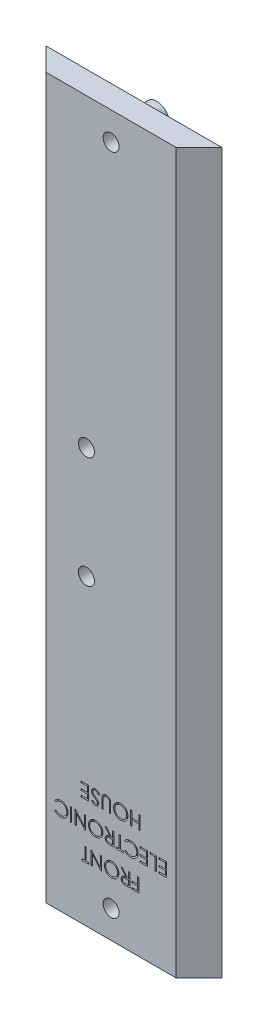
from build123d import *

# Parameters (mm, degrees)
SKETCH3_W           = 157
SKETCH3_H           = 39.86
BOSS_EXTRUDE1_DEPTH = 5
CUT_EXTRUDE2_DEPTH  = 157
SKETCH6_R           = 1.75
CUT_EXTRUDE3_DEPTH  = 5
SKETCH7_R           = 2.75
BOSS_EXTRUDE3_DEPTH = 5
SKETCH8_R           = 1.712369462
SKETCH8_R_2         = 1.75
CUT_EXTRUDE5_DEPTH  = 5
CUT_EXTRUDE8_DEPTH  = 157
BOSS_EXTRUDE5_DEPTH = 0.4
SKETCH14_W          = 0.26923077
SKETCH14_H          = 3
CUT_EXTRUDE9_DEPTH  = 1


with BuildPart() as part:
    # Sketch3 → Boss-Extrude1 (new body)
    with BuildSketch(Plane(origin=(0, 0, 0), x_dir=(0, 1, 0), z_dir=(0, 0, 1))):
        with Locations((78.5, 19.93)):
            Rectangle(SKETCH3_W, SKETCH3_H)
    extrude(amount=BOSS_EXTRUDE1_DEPTH)

    # Sketch4 → Cut-Extrude2 (cut)
    with BuildSketch(Plane.XZ):
        Polygon((-39.86, 5), (-34.861635274, 5), (-39.86, 0), align=None)
        Polygon((0, 0), (0, 5), (-5, 5), align=None)
    extrude(amount=-CUT_EXTRUDE2_DEPTH, mode=Mode.SUBTRACT)

    # Sketch6 → Cut-Extrude3 (cut)
    with BuildSketch(Plane.XY.offset(5)):
        with Locations((-19.930817637, 6.08)):
            Circle(SKETCH6_R)
        with Locations((-19.930817637, 151.28)):
            Circle(SKETCH6_R)
        with Locations((-25.331635274, 90.7)):
            Circle(SKETCH6_R)
        with Locations((-25.331635274, 66.3)):
            Circle(SKETCH6_R)
    extrude(amount=-CUT_EXTRUDE3_DEPTH, mode=Mode.SUBTRACT)

    # Sketch7 → Boss-Extrude3 (add)
    with BuildSketch(Plane(origin=(0, 0, 0), x_dir=(1, 0, 0), z_dir=(0, 0, -1))):
        with Locations(Location((-26.33, -20, 0), (0, 0, 180))):
            Circle(SKETCH7_R)
        with Locations(Location((-13.53, -20, 0), (0, 0, 180))):
            Circle(SKETCH7_R)
        with Locations(Location((-13.53, -40.35, 0), (0, 0, 180))):
            Circle(SKETCH7_R)
        with Locations(Location((-26.33, -40.35, 0), (0, 0, 180))):
            Circle(SKETCH7_R)
        with Locations(Location((-19.930817637, -6.08, 0), (0, 0, 180))):
            Circle(SKETCH7_R)
        with Locations(Location((-19.930817637, -151.28, 0), (0, 0, 180))):
            Circle(SKETCH7_R)
        with Locations(Location((-33.780719465, -93.522998029, 0), (0, 0, 180))):
            Circle(SKETCH7_R)
        with Locations(Location((-33.801017707, -65.312190292, 0), (0, 0, 180))):
            Circle(SKETCH7_R)
        with Locations(Location((-16.973820781, -67.535876943, 0), (0, 0, 180))):
            Circle(SKETCH7_R)
    extrude(amount=BOSS_EXTRUDE3_DEPTH)

    # Sketch8 → Cut-Extrude5 (cut)
    with BuildSketch(Plane(origin=(0, 0, 0), x_dir=(1, 0, 0), z_dir=(0, 0, -1))):
        with Locations(Location((-26.33, -20, 0), (0, 0, 180))):
            Circle(SKETCH8_R)
        with Locations(Location((-26.33, -40.35, 0), (0, 0, 180))):
            Circle(SKETCH8_R)
        with Locations(Location((-13.53, -40.35, 0), (0, 0, 180))):
            Circle(SKETCH8_R)
        with Locations(Location((-13.53, -20, 0), (0, 0, 180))):
            Circle(SKETCH8_R)
        with Locations(Location((-19.930817637, -6.08, 0), (0, 0, 180))):
            Circle(SKETCH8_R)
        with Locations((-19.930817637, -151.28)):
            Circle(SKETCH8_R_2)
        with Locations(Location((-33.801635274, -65.31, 0), (0, 0, 180))):
            Circle(SKETCH8_R_2)
        with Locations(Location((-16.971635274, -67.54, 0), (0, 0, 180))):
            Circle(SKETCH8_R_2)
        with Locations(Location((-33.781635274, -93.52, 0), (0, 0, 180))):
            Circle(SKETCH8_R_2)
    extrude(amount=CUT_EXTRUDE5_DEPTH, mode=Mode.SUBTRACT)

    # Sketch12 → Cut-Extrude8 (cut)
    with BuildSketch(Plane(origin=(0, 157, 0), x_dir=(-1, 0, 0), z_dir=(0, 1, 0))):
        Polygon((0, 0), (0.394619077, -0.30704362), (5.701662696, 5), (5, 5), align=None)
        Polygon((39.86, 0), (39.506446609, -0.353553391), (34.152893219, 5), (34.861635274, 5), align=None)
    extrude(amount=-CUT_EXTRUDE8_DEPTH, mode=Mode.SUBTRACT)

    # Sketch13 → Boss-Extrude5 (add)
    with BuildSketch(Plane(origin=(0, 157, 0), x_dir=(-1, 0, 0), z_dir=(0, 1, 0))):
        Polygon((0.701662696, 0), (5.701662696, 5), (34.152893219, 5), (39.152893219, 0), align=None)
    extrude(amount=BOSS_EXTRUDE5_DEPTH)

    # Sketch14 → Cut-Extrude9 (cut)
    # profile 1 of 20: a face of its own
    with BuildSketch(Plane.XY.offset(5)):
        Polygon((-13.850354881, 12), (-15.311893342, 12), (-15.311893342, 12.307692308), (-14.11958565, 12.307692308), (-14.11958565, 13.230769231), (-15.311893342, 13.230769231), (-15.311893342, 13.538461538), (-14.11958565, 13.538461538), (-14.11958565, 15), (-13.850354881, 15), align=None)
    # profile 2 of 20: a face of its own
    with BuildSketch(Plane.XY.offset(5)):
        with BuildLine():
            Line((-15.850354881, 12), (-16.450715458, 12))
            add(Edge.make_bspline(
                [(-16.450715458, 12), (-16.490779282, 12.000133359), (-16.567706263, 12.000389424), (-16.677911923, 12.001817221), (-16.778049435, 12.005909526), (-16.86806644, 12.009431169), (-16.947961287, 12.015852833), (-17.017978965, 12.02199053), (-17.077796991, 12.030025097), (-17.114007721, 12.037486888), (-17.130402958, 12.040865385)],
                knots=[0, 0, 0, 0, 1.410062039, 2.707475311, 3.878576406, 4.937260626, 5.877586885, 6.699081471, 7.410979367, 8, 8, 8, 8], degree=3))
            add(Edge.make_bspline(
                [(-17.130402958, 12.040865385), (-17.152351862, 12.046287726), (-17.195781441, 12.057016735), (-17.258304708, 12.079705105), (-17.317908194, 12.105918357), (-17.374373631, 12.136941955), (-17.427686221, 12.172252027), (-17.477840595, 12.21199052), (-17.524164279, 12.256497911), (-17.5683054, 12.30393053), (-17.606849031, 12.356353534), (-17.641548523, 12.411106595), (-17.670677558, 12.469243846), (-17.693598858, 12.530472055), (-17.712814454, 12.594190605), (-17.725729129, 12.661029122), (-17.733772615, 12.730770147), (-17.734567311, 12.778222678), (-17.734970265, 12.802283654)],
                knots=[0, 0, 0, 0, 1.027276577, 2.032638556, 3.019345632, 3.985365262, 4.957888996, 5.923693931, 6.890056973, 7.876427719, 8.865527834, 9.843495157, 10.821038291, 11.815616373, 12.812734995, 13.843357168, 14.906466538, 16, 16, 16, 16], degree=3))
            add(Edge.make_bspline(
                [(-17.734970265, 12.802283654), (-17.733711157, 12.842256647), (-17.73125431, 12.920254309), (-17.708346622, 13.033448708), (-17.67082556, 13.139041898), (-17.619113734, 13.236886932), (-17.553291228, 13.325128092), (-17.474187543, 13.402371039), (-17.382206657, 13.467606228), (-17.296176467, 13.512363317), (-17.220145852, 13.541161946), (-17.157368992, 13.561526488), (-17.088838052, 13.576995325), (-17.015536211, 13.591054337), (-16.936897279, 13.601782492), (-16.853079616, 13.609401521), (-16.763873588, 13.614300615), (-16.702725221, 13.615016394), (-16.671268342, 13.615384615)],
                knots=[0, 0, 0, 0, 1.260402266, 2.459371274, 3.627181936, 4.786749125, 5.93865593, 7.087644312, 8.261344208, 9.485713728, 10.136162886, 10.825977872, 11.566646758, 12.35154167, 13.181268117, 14.0701832, 15.007234106, 16, 16, 16, 16], degree=3))
            Line((-16.671268342, 13.615384615), (-17.773431804, 15))
            Line((-17.773431804, 15), (-17.440499111, 15))
            Line((-17.440499111, 15), (-16.33833565, 13.615384615))
            Line((-16.33833565, 13.615384615), (-16.11958565, 13.615384615))
            Line((-16.11958565, 13.615384615), (-16.11958565, 15))
            Line((-16.11958565, 15), (-15.850354881, 15))
            Line((-15.850354881, 15), (-15.850354881, 12))
        make_face()
        with BuildLine():
            Line((-16.11958565, 12.307692308), (-16.11958565, 13.307692308))
            Line((-16.11958565, 13.307692308), (-16.668864496, 13.311899038))
            add(Edge.make_bspline(
                [(-16.668864496, 13.311899038), (-16.694510247, 13.311910391), (-16.744219016, 13.311932395), (-16.816133828, 13.30850907), (-16.883094073, 13.304615097), (-16.944842792, 13.298657514), (-17.001410347, 13.290984171), (-17.052759374, 13.281370882), (-17.099003348, 13.270218368), (-17.152765612, 13.252780552), (-17.213490178, 13.226344724), (-17.27812331, 13.185353674), (-17.334643133, 13.135781041), (-17.381633125, 13.078378592), (-17.41937554, 13.014994425), (-17.44559101, 12.947063018), (-17.462866851, 12.875654696), (-17.464770908, 12.826624311), (-17.465739496, 12.801682692)],
                knots=[0, 0, 0, 0, 1.146399208, 2.222048177, 3.218135709, 4.144938032, 4.994811973, 5.769438708, 6.479732432, 7.119818093, 8.294689872, 9.430121864, 10.527913442, 11.641375077, 12.733452768, 13.811150417, 14.886538365, 16, 16, 16, 16], degree=3))
            add(Edge.make_bspline(
                [(-17.465739496, 12.801682692), (-17.464721865, 12.77755234), (-17.46270529, 12.729734785), (-17.445866078, 12.659888671), (-17.418370312, 12.593474183), (-17.380735665, 12.531405229), (-17.333895311, 12.475480225), (-17.279336847, 12.427776116), (-17.218344157, 12.388144903), (-17.161799964, 12.361996131), (-17.110890277, 12.346610154), (-17.066891813, 12.335441489), (-17.016743865, 12.327619463), (-16.961036669, 12.320425288), (-16.899525506, 12.314332925), (-16.832172892, 12.310289114), (-16.759026984, 12.307872121), (-16.708329628, 12.307753641), (-16.68208565, 12.307692308)],
                knots=[0, 0, 0, 0, 1.100596872, 2.180981401, 3.259506136, 4.371595435, 5.481727359, 6.576991111, 7.667816242, 8.793363246, 9.406619729, 10.09427138, 10.864108636, 11.721733836, 12.6590937, 13.685439239, 14.801845161, 16, 16, 16, 16], degree=3))
            Line((-16.68208565, 12.307692308), (-16.11958565, 12.307692308))
        make_face(mode=Mode.SUBTRACT)
    # profile 3 of 20: a face of its own
    with BuildSketch(Plane.XY.offset(5)):
        with BuildLine():
            add(Edge.make_bspline(
                [(-19.792662573, 11.923076923), (-19.848218424, 11.924460232), (-19.957334698, 11.927177166), (-20.117553303, 11.948661086), (-20.270969071, 11.98402234), (-20.417673632, 12.033956593), (-20.557096418, 12.098702264), (-20.689678224, 12.177304961), (-20.81496333, 12.270537195), (-20.932627694, 12.376185793), (-21.039573223, 12.492315675), (-21.132633164, 12.616989285), (-21.211835853, 12.747697291), (-21.276547281, 12.88529091), (-21.327395284, 13.029155827), (-21.362463127, 13.180149078), (-21.384868792, 13.337267976), (-21.387487818, 13.444434015), (-21.388816419, 13.498798077)],
                knots=[0, 0, 0, 0, 1.065027606, 2.091802087, 3.093458616, 4.079833113, 5.057734272, 6.036020118, 7.030157768, 8.047461502, 9.064242947, 10.052216774, 11.02588392, 11.989864716, 12.962978571, 13.945936472, 14.957997893, 16, 16, 16, 16], degree=3))
            add(Edge.make_bspline(
                [(-21.388816419, 13.498798077), (-21.387487373, 13.552761369), (-21.384867669, 13.65912927), (-21.362444921, 13.815255565), (-21.327238899, 13.96532103), (-21.277176318, 14.108976633), (-21.212417224, 14.246292907), (-21.133089909, 14.377092365), (-21.040239046, 14.502129509), (-20.933731997, 14.618824704), (-20.81742543, 14.725780098), (-20.693522087, 14.820330275), (-20.562171482, 14.899095993), (-20.425423676, 14.964774801), (-20.281917725, 15.014517724), (-20.132665739, 15.050766295), (-19.976821449, 15.072946155), (-19.870660186, 15.07558289), (-19.816701034, 15.076923077)],
                knots=[0, 0, 0, 0, 1.043683505, 2.0572211, 3.045299494, 4.022276905, 4.994977706, 5.977452478, 6.97747046, 8.003698437, 9.029677512, 10.031249186, 11.013723958, 11.988083691, 12.9614021, 13.946617861, 14.956316495, 16, 16, 16, 16], degree=3))
            add(Edge.make_bspline(
                [(-19.816701034, 15.076923077), (-19.762337226, 15.075595209), (-19.655171689, 15.072977629), (-19.497855754, 15.050533869), (-19.346754956, 15.015450694), (-19.20233453, 14.965265467), (-19.064547086, 14.900651121), (-18.933405948, 14.821249686), (-18.80875353, 14.727685999), (-18.691858315, 14.621262592), (-18.58503189, 14.505179049), (-18.491071881, 14.381438394), (-18.412128212, 14.251217469), (-18.347486589, 14.115053071), (-18.296357527, 13.973297161), (-18.261464452, 13.825058041), (-18.238891655, 13.671166376), (-18.236290238, 13.56638684), (-18.234970265, 13.513221154)],
                knots=[0, 0, 0, 0, 1.053167129, 2.076072758, 3.073341244, 4.055601477, 5.033424535, 6.017524495, 7.021518915, 8.049444456, 9.077120685, 10.074910483, 11.055688766, 12.022980584, 12.991883888, 13.970269434, 14.970104079, 16, 16, 16, 16], degree=3))
            add(Edge.make_bspline(
                [(-18.234970265, 13.513221154), (-18.235428104, 13.477535846), (-18.236338006, 13.406615416), (-18.247308496, 13.301303587), (-18.263195354, 13.197674029), (-18.286082808, 13.096075095), (-18.315605683, 12.996490195), (-18.351987618, 12.899122984), (-18.393681329, 12.803171442), (-18.443323451, 12.710461699), (-18.497484492, 12.620848239), (-18.556541666, 12.535451605), (-18.620906746, 12.45579721), (-18.689660293, 12.380605136), (-18.763754009, 12.311158741), (-18.842072787, 12.245943934), (-18.925026426, 12.185635794), (-19.012746119, 12.131500958), (-19.102995419, 12.081777454), (-19.19642909, 12.04026242), (-19.291075774, 12.003568697), (-19.387769158, 11.974408069), (-19.486285573, 11.951201867), (-19.586748175, 11.93543384), (-19.68905349, 11.924438973), (-19.75797762, 11.923532893), (-19.792662573, 11.923076923)],
                knots=[0, 0, 0, 0, 1.037115869, 2.061148057, 3.07517727, 4.084041727, 5.086514338, 6.092668487, 7.104487461, 8.125783165, 9.147610153, 10.147694368, 11.141876323, 12.122903372, 13.107606018, 14.091946891, 15.084523921, 16.086505767, 17.087268121, 18.077809654, 19.05670789, 20.036870126, 21.011670792, 21.99694167, 22.991993299, 24, 24, 24, 24], degree=3))
        make_face()
        with BuildLine():
            add(Edge.make_bspline(
                [(-19.805883727, 12.230769231), (-19.777413612, 12.231114903), (-19.720745557, 12.231802943), (-19.636508017, 12.24092248), (-19.553348172, 12.253814324), (-19.471448722, 12.272585726), (-19.390736426, 12.296637826), (-19.311121695, 12.326338727), (-19.232533432, 12.361012516), (-19.155690287, 12.401260994), (-19.081819475, 12.446375359), (-19.010477134, 12.493940878), (-18.944387917, 12.546653502), (-18.882275287, 12.602558455), (-18.824289937, 12.662425469), (-18.77042412, 12.725813531), (-18.720730906, 12.793009612), (-18.675805945, 12.863733738), (-18.635826362, 12.937591963), (-18.600030931, 13.013172188), (-18.570357893, 13.091362704), (-18.546852424, 13.171675562), (-18.526901667, 13.253756845), (-18.514387076, 13.33805376), (-18.505180164, 13.424275706), (-18.504529924, 13.482546199), (-18.504201034, 13.512019231)],
                knots=[0, 0, 0, 0, 1.008431664, 2.007222653, 2.999229743, 3.989431819, 4.982149843, 5.98167215, 6.998687425, 8.024288174, 9.053028776, 10.065052016, 11.06063401, 12.045759335, 13.024701188, 14.011819507, 14.991481775, 15.984022113, 16.97831254, 17.965966747, 18.945551853, 19.938269878, 20.93007375, 21.936103907, 22.956087853, 24, 24, 24, 24], degree=3))
            add(Edge.make_bspline(
                [(-18.504201034, 13.512019231), (-18.505296273, 13.555357292), (-18.507450947, 13.640616665), (-18.526236051, 13.765574847), (-18.555401779, 13.885781868), (-18.597686576, 14.000521247), (-18.651629179, 14.110304639), (-18.717428203, 14.214704806), (-18.795686228, 14.313690952), (-18.884528188, 14.406526223), (-18.981674529, 14.49122692), (-19.084780204, 14.565679277), (-19.19302948, 14.628340458), (-19.305798435, 14.680723797), (-19.424049871, 14.720187225), (-19.547025606, 14.748324631), (-19.674728358, 14.766561284), (-19.761750382, 14.768332496), (-19.805883727, 14.769230769)],
                knots=[0, 0, 0, 0, 1.032022337, 2.030307203, 3.003823408, 3.974715386, 4.937372378, 5.913284036, 6.909147208, 7.938749767, 8.970518239, 9.975863271, 10.963918693, 11.946286286, 12.933361397, 13.927862637, 14.949112547, 16, 16, 16, 16], degree=3))
            add(Edge.make_bspline(
                [(-19.805883727, 14.769230769), (-19.835549131, 14.768823524), (-19.894384539, 14.768015835), (-19.981893263, 14.759869275), (-20.067833626, 14.746831538), (-20.152046561, 14.727966818), (-20.23464343, 14.704670283), (-20.315371203, 14.675768839), (-20.394217336, 14.641139654), (-20.471515764, 14.602484651), (-20.54559221, 14.558889057), (-20.615605452, 14.510988185), (-20.682015909, 14.460064616), (-20.744015167, 14.404564524), (-20.801758439, 14.345202517), (-20.854661551, 14.281546269), (-20.904331596, 14.21485357), (-20.94894146, 14.144147421), (-20.989469485, 14.070873611), (-21.024213375, 13.995073363), (-21.053903464, 13.917226768), (-21.077832411, 13.837257003), (-21.096594017, 13.755349206), (-21.109518946, 13.671384731), (-21.118560659, 13.585533976), (-21.119242127, 13.527467799), (-21.11958565, 13.498197115)],
                knots=[0, 0, 0, 0, 1.047362266, 2.077233941, 3.100744636, 4.115120168, 5.122788643, 6.129711893, 7.140355774, 8.162227187, 9.180148637, 10.17298275, 11.156396779, 12.133377858, 13.108923632, 14.078087502, 15.054351192, 16.043448276, 17.028082865, 18.009331763, 18.985518559, 19.968016174, 20.954783108, 21.950335389, 22.966780876, 24, 24, 24, 24], degree=3))
            add(Edge.make_bspline(
                [(-21.11958565, 13.498197115), (-21.119241839, 13.469126683), (-21.118559826, 13.411460126), (-21.109523419, 13.326207996), (-21.096579799, 13.2428481), (-21.077926049, 13.161707698), (-21.053883061, 13.082766104), (-21.024236774, 13.006097468), (-20.989277959, 12.93141614), (-20.949156577, 12.85890681), (-20.904057472, 12.789328211), (-20.854776055, 12.722812792), (-20.800465276, 12.660604097), (-20.742662651, 12.601187406), (-20.67997849, 12.545751127), (-20.612401804, 12.494509642), (-20.54161536, 12.445153469), (-20.466017619, 12.401474798), (-20.388280162, 12.360927742), (-20.308431082, 12.326363664), (-20.227468887, 12.296505898), (-20.145285443, 12.272689313), (-20.062022715, 12.253796089), (-19.977657569, 12.240927152), (-19.89222133, 12.231801963), (-19.834754254, 12.231114567), (-19.805883727, 12.230769231)],
                knots=[0, 0, 0, 0, 1.02988216, 2.042960975, 3.035124439, 4.018561492, 4.99104521, 5.957523397, 6.929462691, 7.91146347, 8.892205782, 9.866320947, 10.842813644, 11.816825305, 12.802668543, 13.805243666, 14.821427616, 15.858893029, 16.897256944, 17.927432741, 18.940436917, 19.95373962, 20.957947499, 21.96413624, 22.977215056, 24, 24, 24, 24], degree=3))
        make_face(mode=Mode.SUBTRACT)
    # profile 4 of 20: a face of its own
    with BuildSketch(Plane.XY.offset(5)):
        Polygon((-22.004201034, 15), (-22.004201034, 12), (-22.060691419, 12), (-24.042662573, 14.361177885), (-24.042662573, 12), (-24.311893342, 12), (-24.311893342, 15), (-24.250595265, 15), (-22.273431804, 12.644230769), (-22.273431804, 15), align=None)
    # profile 5 of 20: a face of its own
    with BuildSketch(Plane.XY.offset(5)):
        Polygon((-24.734970265, 12.307692308), (-24.734970265, 12), (-26.311893342, 12), (-26.311893342, 12.307692308), (-25.658047188, 12.307692308), (-25.658047188, 15), (-25.388816419, 15), (-25.388816419, 12.307692308), align=None)
    # profile 6 of 20: a face of its own
    with BuildSketch(Plane.XY.offset(5)):
        Polygon((-7.811893342, 17.961538462), (-9.504201034, 17.961538462), (-9.504201034, 18.269230769), (-8.081124111, 18.269230769), (-8.081124111, 19.192307692), (-9.504201034, 19.192307692), (-9.504201034, 19.5), (-8.081124111, 19.5), (-8.081124111, 20.653846154), (-9.504201034, 20.653846154), (-9.504201034, 20.961538462), (-7.811893342, 20.961538462), align=None)
    # profile 7 of 20: a face of its own
    with BuildSketch(Plane.XY.offset(5)):
        Polygon((-10.042662573, 17.961538462), (-10.311893342, 17.961538462), (-10.311893342, 20.653846154), (-11.465739496, 20.653846154), (-11.465739496, 20.961538462), (-10.042662573, 20.961538462), align=None)
    # profile 8 of 20: a face of its own
    with BuildSketch(Plane.XY.offset(5)):
        Polygon((-11.965739496, 17.961538462), (-13.658047188, 17.961538462), (-13.658047188, 18.269230769), (-12.234970265, 18.269230769), (-12.234970265, 19.192307692), (-13.658047188, 19.192307692), (-13.658047188, 19.5), (-12.234970265, 19.5), (-12.234970265, 20.653846154), (-13.658047188, 20.653846154), (-13.658047188, 20.961538462), (-11.965739496, 20.961538462), align=None)
    # profile 9 of 20: a face of its own
    with BuildSketch(Plane.XY.offset(5)):
        with BuildLine():
            Line((-16.965739496, 18.512019231), (-16.730162573, 18.692307692))
            add(Edge.make_bspline(
                [(-16.730162573, 18.692307692), (-16.713357353, 18.672279983), (-16.679973485, 18.632494582), (-16.626268129, 18.576622508), (-16.570285821, 18.524295417), (-16.512104454, 18.475177102), (-16.450377575, 18.431241728), (-16.387457153, 18.389067572), (-16.321057009, 18.352142647), (-16.229704555, 18.307034232), (-16.109733991, 18.260989939), (-15.959232698, 18.221387872), (-15.801907711, 18.19641572), (-15.694599585, 18.19369272), (-15.640018342, 18.192307692)],
                knots=[0, 0, 0, 0, 0.75789156, 1.505565099, 2.245254514, 2.979266606, 3.711207489, 4.440978832, 5.174393176, 5.91211879, 7.394186119, 8.890401545, 10.418332761, 12, 12, 12, 12], degree=3))
            add(Edge.make_bspline(
                [(-15.640018342, 18.192307692), (-15.609947308, 18.192655508), (-15.550084328, 18.193347912), (-15.461237385, 18.202418391), (-15.373881214, 18.215313879), (-15.288340662, 18.233982776), (-15.204785571, 18.258287985), (-15.122579747, 18.286791511), (-15.04269133, 18.322261243), (-14.964158969, 18.361432877), (-14.888922925, 18.405689436), (-14.817722505, 18.453947327), (-14.75087883, 18.505729821), (-14.688221905, 18.560914548), (-14.630383095, 18.620145751), (-14.576747952, 18.682757933), (-14.527384937, 18.749033854), (-14.482344979, 18.818656845), (-14.442059577, 18.891282989), (-14.407125588, 18.966600325), (-14.377596113, 19.04432112), (-14.35363994, 19.12427881), (-14.334890859, 19.206190364), (-14.321912502, 19.29034907), (-14.31292559, 19.376607823), (-14.312239288, 19.435072769), (-14.311893342, 19.464543269)],
                knots=[0, 0, 0, 0, 1.054960097, 2.100129169, 3.131228542, 4.15308236, 5.169990287, 6.183953224, 7.204064171, 8.235355279, 9.262684623, 10.264978336, 11.252191258, 12.228402777, 13.192898315, 14.155264692, 15.119862721, 16.091023151, 17.063429752, 18.032246104, 19.00241354, 19.978852882, 20.959535218, 21.948948728, 22.966123959, 24, 24, 24, 24], degree=3))
            add(Edge.make_bspline(
                [(-14.311893342, 19.464543269), (-14.312977437, 19.508883412), (-14.315105915, 19.595939401), (-14.333968486, 19.723471099), (-14.362862249, 19.845763835), (-14.405457141, 19.961989575), (-14.459026977, 20.073117203), (-14.52586736, 20.177799067), (-14.603573227, 20.277568789), (-14.69294174, 20.370010003), (-14.791006461, 20.454449145), (-14.896218269, 20.528807103), (-15.008319269, 20.590791204), (-15.126070617, 20.642370609), (-15.250378728, 20.682019227), (-15.381019984, 20.709931334), (-15.517710267, 20.728138917), (-15.611112609, 20.729882078), (-15.65864815, 20.730769231)],
                knots=[0, 0, 0, 0, 1.029159485, 2.020618137, 2.987588728, 3.942669054, 4.889339625, 5.846988364, 6.821327795, 7.821533711, 8.827683044, 9.822769455, 10.807800696, 11.797391277, 12.803701919, 13.832062008, 14.896664671, 16, 16, 16, 16], degree=3))
            add(Edge.make_bspline(
                [(-15.65864815, 20.730769231), (-15.711021883, 20.729321705), (-15.814105919, 20.726472629), (-15.965278513, 20.70233613), (-16.109994884, 20.663200771), (-16.248262815, 20.608431124), (-16.379692512, 20.537232306), (-16.50448965, 20.450919839), (-16.622759567, 20.348672697), (-16.693877809, 20.270601444), (-16.730162573, 20.230769231)],
                knots=[0, 0, 0, 0, 1.028121516, 2.023589091, 2.998037872, 3.967518031, 4.937445131, 5.927275754, 6.942489185, 8, 8, 8, 8], degree=3))
            Line((-16.730162573, 20.230769231), (-16.965739496, 20.409254808))
            add(Edge.make_bspline(
                [(-16.965739496, 20.409254808), (-16.946780477, 20.433715533), (-16.90895325, 20.482519819), (-16.847713008, 20.551336077), (-16.783154172, 20.616009233), (-16.715102463, 20.676202473), (-16.643469044, 20.732216663), (-16.568285223, 20.783791349), (-16.489925991, 20.831498649), (-16.408293229, 20.874739711), (-16.323382471, 20.913217034), (-16.235921381, 20.946846126), (-16.145749749, 20.975084234), (-16.053578649, 20.99881009), (-15.958461027, 21.015754884), (-15.861485194, 21.029240346), (-15.761748243, 21.037242703), (-15.694519679, 21.038051615), (-15.660451034, 21.038461538)],
                knots=[0, 0, 0, 0, 0.986880684, 1.969034265, 2.935876267, 3.899990983, 4.864973347, 5.834408638, 6.8063673, 7.789580233, 8.778939794, 9.778051223, 10.776304221, 11.791326552, 12.811423977, 13.855999788, 14.91350973, 16, 16, 16, 16], degree=3))
            add(Edge.make_bspline(
                [(-15.660451034, 21.038461538), (-15.628185034, 21.038236973), (-15.564383014, 21.037792924), (-15.470184084, 21.030599637), (-15.378478729, 21.020785577), (-15.28952905, 21.006008322), (-15.202849643, 20.988570316), (-15.119226284, 20.965194953), (-15.037836104, 20.939009954), (-14.959006098, 20.908234251), (-14.882669212, 20.873506094), (-14.80907166, 20.834256187), (-14.738247289, 20.790814588), (-14.669499786, 20.744138865), (-14.603844714, 20.692729749), (-14.540713121, 20.637301205), (-14.479750998, 20.578040053), (-14.442034411, 20.535307322), (-14.423071227, 20.513822115)],
                knots=[0, 0, 0, 0, 1.114604814, 2.203992996, 3.262667896, 4.300477797, 5.318619304, 6.316056647, 7.298880507, 8.271930387, 9.238335007, 10.195173496, 11.151986948, 12.108099108, 13.064862484, 14.031167946, 15.010108607, 16, 16, 16, 16], degree=3))
            add(Edge.make_bspline(
                [(-14.423071227, 20.513822115), (-14.392699799, 20.476500326), (-14.332323614, 20.40230733), (-14.25504386, 20.282073539), (-14.189113363, 20.156651057), (-14.135211062, 20.025313416), (-14.093807807, 19.888009558), (-14.064698627, 19.744960366), (-14.045914518, 19.596451801), (-14.043758493, 19.495450263), (-14.042662573, 19.444110577)],
                knots=[0, 0, 0, 0, 0.994611881, 1.977215934, 2.950189954, 3.921972279, 4.908960509, 5.911694611, 6.938501887, 8, 8, 8, 8], degree=3))
            add(Edge.make_bspline(
                [(-14.042662573, 19.444110577), (-14.044001558, 19.390151017), (-14.046635928, 19.283988952), (-14.068832941, 19.128150484), (-14.104973967, 18.979061055), (-14.1547404, 18.836147004), (-14.220395631, 18.700226032), (-14.299876598, 18.570724086), (-14.393959638, 18.44774691), (-14.501463157, 18.332866777), (-14.619384228, 18.227835845), (-14.745655873, 18.135429796), (-14.880040827, 18.058529261), (-15.021056014, 17.994246784), (-15.169758058, 17.944837258), (-15.325829508, 17.910248809), (-15.488977152, 17.888719853), (-15.600287802, 17.885998246), (-15.656845265, 17.884615385)],
                knots=[0, 0, 0, 0, 1.032901378, 2.032168977, 3.007206631, 3.966850309, 4.924221947, 5.891988639, 6.871730993, 7.884084801, 8.900290346, 9.89161143, 10.874607481, 11.860025555, 12.854717796, 13.869097222, 14.917278314, 16, 16, 16, 16], degree=3))
            add(Edge.make_bspline(
                [(-15.656845265, 17.884615385), (-15.691314767, 17.885028697), (-15.759543674, 17.885846806), (-15.86047518, 17.893822764), (-15.958737603, 17.907122845), (-16.054604295, 17.925248647), (-16.148233383, 17.94779366), (-16.23920409, 17.976022994), (-16.327255761, 18.010154126), (-16.412982129, 18.04814123), (-16.495284039, 18.09164672), (-16.574120551, 18.138935231), (-16.648851529, 18.190917381), (-16.719962759, 18.246835026), (-16.787125473, 18.307118334), (-16.851347644, 18.370754021), (-16.910722376, 18.439430147), (-16.947366885, 18.487778577), (-16.965739496, 18.512019231)],
                knots=[0, 0, 0, 0, 1.096566765, 2.170543479, 3.218870886, 4.250164525, 5.273529809, 6.281496242, 7.278154839, 8.276706968, 9.263143576, 10.238168486, 11.199979644, 12.157579042, 13.114563119, 14.070017788, 15.032356758, 16, 16, 16, 16], degree=3))
        make_face()
    # profile 10 of 20: a face of its own
    with BuildSketch(Plane.XY.offset(5)):
        Polygon((-17.234970265, 18.269230769), (-17.234970265, 17.961538462), (-18.811893342, 17.961538462), (-18.811893342, 18.269230769), (-18.158047188, 18.269230769), (-18.158047188, 20.961538462), (-17.888816419, 20.961538462), (-17.888816419, 18.269230769), align=None)
    # profile 11 of 20: a face of its own
    with BuildSketch(Plane.XY.offset(5)):
        with BuildLine():
            Line((-19.350354881, 17.961538462), (-19.950715458, 17.961538462))
            add(Edge.make_bspline(
                [(-19.950715458, 17.961538462), (-19.990779282, 17.961671821), (-20.067706263, 17.961927886), (-20.177911923, 17.963355683), (-20.278049435, 17.967447987), (-20.36806644, 17.97096963), (-20.447961287, 17.977391294), (-20.517978965, 17.983528992), (-20.577796991, 17.991563558), (-20.614007721, 17.999025349), (-20.630402958, 18.002403846)],
                knots=[0, 0, 0, 0, 1.410062039, 2.707475311, 3.878576406, 4.937260626, 5.877586885, 6.699081471, 7.410979367, 8, 8, 8, 8], degree=3))
            add(Edge.make_bspline(
                [(-20.630402958, 18.002403846), (-20.652351862, 18.007826187), (-20.695781441, 18.018555197), (-20.758304708, 18.041243566), (-20.817908194, 18.067456819), (-20.874373631, 18.098480417), (-20.927686221, 18.133790489), (-20.977840595, 18.173528981), (-21.024164279, 18.218036372), (-21.0683054, 18.265468991), (-21.106849031, 18.317891995), (-21.141548523, 18.372645056), (-21.170677558, 18.430782307), (-21.193598858, 18.492010516), (-21.212814454, 18.555729067), (-21.225729129, 18.622567584), (-21.233772615, 18.692308609), (-21.234567311, 18.73976114), (-21.234970265, 18.763822115)],
                knots=[0, 0, 0, 0, 1.027276577, 2.032638556, 3.019345632, 3.985365262, 4.957888996, 5.923693931, 6.890056973, 7.876427719, 8.865527834, 9.843495157, 10.821038291, 11.815616373, 12.812734995, 13.843357168, 14.906466538, 16, 16, 16, 16], degree=3))
            add(Edge.make_bspline(
                [(-21.234970265, 18.763822115), (-21.233711157, 18.803795108), (-21.23125431, 18.88179277), (-21.208346622, 18.994987169), (-21.17082556, 19.10058036), (-21.119113734, 19.198425393), (-21.053291228, 19.286666553), (-20.974187543, 19.363909501), (-20.882206657, 19.429144689), (-20.796176467, 19.473901778), (-20.720145852, 19.502700407), (-20.657368992, 19.523064949), (-20.588838052, 19.538533787), (-20.515536211, 19.552592798), (-20.436897279, 19.563320954), (-20.353079616, 19.570939983), (-20.263873588, 19.575839077), (-20.202725221, 19.576554855), (-20.171268342, 19.576923077)],
                knots=[0, 0, 0, 0, 1.260402266, 2.459371274, 3.627181936, 4.786749125, 5.93865593, 7.087644312, 8.261344208, 9.485713728, 10.136162886, 10.825977872, 11.566646758, 12.35154167, 13.181268117, 14.0701832, 15.007234106, 16, 16, 16, 16], degree=3))
            Line((-20.171268342, 19.576923077), (-21.273431804, 20.961538462))
            Line((-21.273431804, 20.961538462), (-20.940499111, 20.961538462))
            Line((-20.940499111, 20.961538462), (-19.83833565, 19.576923077))
            Line((-19.83833565, 19.576923077), (-19.61958565, 19.576923077))
            Line((-19.61958565, 19.576923077), (-19.61958565, 20.961538462))
            Line((-19.61958565, 20.961538462), (-19.350354881, 20.961538462))
            Line((-19.350354881, 20.961538462), (-19.350354881, 17.961538462))
        make_face()
        with BuildLine():
            Line((-19.61958565, 18.269230769), (-19.61958565, 19.269230769))
            Line((-19.61958565, 19.269230769), (-20.168864496, 19.2734375))
            add(Edge.make_bspline(
                [(-20.168864496, 19.2734375), (-20.194510247, 19.273448852), (-20.244219016, 19.273470856), (-20.316133828, 19.270047531), (-20.383094073, 19.266153558), (-20.444842792, 19.260195975), (-20.501410347, 19.252522632), (-20.552759374, 19.242909343), (-20.599003348, 19.23175683), (-20.652765612, 19.214319014), (-20.713490178, 19.187883185), (-20.77812331, 19.146892135), (-20.834643133, 19.097319502), (-20.881633125, 19.039917053), (-20.91937554, 18.976532887), (-20.94559101, 18.908601479), (-20.962866851, 18.837193158), (-20.964770908, 18.788162773), (-20.965739496, 18.763221154)],
                knots=[0, 0, 0, 0, 1.146399208, 2.222048177, 3.218135709, 4.144938032, 4.994811973, 5.769438708, 6.479732432, 7.119818093, 8.294689872, 9.430121864, 10.527913442, 11.641375077, 12.733452768, 13.811150417, 14.886538365, 16, 16, 16, 16], degree=3))
            add(Edge.make_bspline(
                [(-20.965739496, 18.763221154), (-20.964721865, 18.739090801), (-20.96270529, 18.691273247), (-20.945866078, 18.621427133), (-20.918370312, 18.555012645), (-20.880735665, 18.492943691), (-20.833895311, 18.437018687), (-20.779336847, 18.389314578), (-20.718344157, 18.349683364), (-20.661799964, 18.323534593), (-20.610890277, 18.308148615), (-20.566891813, 18.296979951), (-20.516743865, 18.289157925), (-20.461036669, 18.28196375), (-20.399525506, 18.275871386), (-20.332172892, 18.271827575), (-20.259026984, 18.269410583), (-20.208329628, 18.269292102), (-20.18208565, 18.269230769)],
                knots=[0, 0, 0, 0, 1.100596872, 2.180981401, 3.259506136, 4.371595435, 5.481727359, 6.576991111, 7.667816242, 8.793363246, 9.406619729, 10.09427138, 10.864108636, 11.721733836, 12.6590937, 13.685439239, 14.801845161, 16, 16, 16, 16], degree=3))
            Line((-20.18208565, 18.269230769), (-19.61958565, 18.269230769))
        make_face(mode=Mode.SUBTRACT)
    # profile 12 of 20: a face of its own
    with BuildSketch(Plane.XY.offset(5)):
        with BuildLine():
            add(Edge.make_bspline(
                [(-23.292662573, 17.884615385), (-23.348218424, 17.885998694), (-23.457334698, 17.888715627), (-23.617553303, 17.910199548), (-23.770969071, 17.945560802), (-23.917673632, 17.995495055), (-24.057096418, 18.060240726), (-24.189678224, 18.138843423), (-24.31496333, 18.232075656), (-24.432627694, 18.337724254), (-24.539573223, 18.453854137), (-24.632633164, 18.578527746), (-24.711835853, 18.709235753), (-24.776547281, 18.846829371), (-24.827395284, 18.990694289), (-24.862463127, 19.141687539), (-24.884868792, 19.298806438), (-24.887487818, 19.405972476), (-24.888816419, 19.460336538)],
                knots=[0, 0, 0, 0, 1.065027606, 2.091802087, 3.093458616, 4.079833113, 5.057734272, 6.036020118, 7.030157768, 8.047461502, 9.064242947, 10.052216774, 11.02588392, 11.989864716, 12.962978571, 13.945936472, 14.957997893, 16, 16, 16, 16], degree=3))
            add(Edge.make_bspline(
                [(-24.888816419, 19.460336538), (-24.887487373, 19.514299831), (-24.884867669, 19.620667731), (-24.862444921, 19.776794027), (-24.827238899, 19.926859492), (-24.777176318, 20.070515094), (-24.712417224, 20.207831368), (-24.633089909, 20.338630827), (-24.540239046, 20.46366797), (-24.433731997, 20.580363165), (-24.31742543, 20.687318559), (-24.193522087, 20.781868736), (-24.062171482, 20.860634455), (-23.925423676, 20.926313263), (-23.781917725, 20.976056186), (-23.632665739, 21.012304756), (-23.476821449, 21.034484617), (-23.370660186, 21.037121351), (-23.316701034, 21.038461538)],
                knots=[0, 0, 0, 0, 1.043683505, 2.0572211, 3.045299494, 4.022276905, 4.994977706, 5.977452478, 6.97747046, 8.003698437, 9.029677512, 10.031249186, 11.013723958, 11.988083691, 12.9614021, 13.946617861, 14.956316495, 16, 16, 16, 16], degree=3))
            add(Edge.make_bspline(
                [(-23.316701034, 21.038461538), (-23.262337226, 21.037133671), (-23.155171689, 21.03451609), (-22.997855754, 21.012072331), (-22.846754956, 20.976989156), (-22.70233453, 20.926803928), (-22.564547086, 20.862189583), (-22.433405948, 20.782788147), (-22.30875353, 20.689224461), (-22.191858315, 20.582801053), (-22.08503189, 20.466717511), (-21.991071881, 20.342976855), (-21.912128212, 20.212755931), (-21.847486589, 20.076591533), (-21.796357527, 19.934835622), (-21.761464452, 19.786596502), (-21.738891655, 19.632704838), (-21.736290238, 19.527925301), (-21.734970265, 19.474759615)],
                knots=[0, 0, 0, 0, 1.053167129, 2.076072758, 3.073341244, 4.055601477, 5.033424535, 6.017524495, 7.021518915, 8.049444456, 9.077120685, 10.074910483, 11.055688766, 12.022980584, 12.991883888, 13.970269434, 14.970104079, 16, 16, 16, 16], degree=3))
            add(Edge.make_bspline(
                [(-21.734970265, 19.474759615), (-21.735428104, 19.439074307), (-21.736338006, 19.368153877), (-21.747308496, 19.262842048), (-21.763195354, 19.159212491), (-21.786082808, 19.057613557), (-21.815605683, 18.958028656), (-21.851987618, 18.860661445), (-21.893681329, 18.764709904), (-21.943323451, 18.672000161), (-21.997484492, 18.582386701), (-22.056541666, 18.496990066), (-22.120906746, 18.417335671), (-22.189660293, 18.342143597), (-22.263754009, 18.272697203), (-22.342072787, 18.207482395), (-22.425026426, 18.147174256), (-22.512746119, 18.09303942), (-22.602995419, 18.043315916), (-22.69642909, 18.001800882), (-22.791075774, 17.965107159), (-22.887769158, 17.935946531), (-22.986285573, 17.912740329), (-23.086748175, 17.896972301), (-23.18905349, 17.885977434), (-23.25797762, 17.885071355), (-23.292662573, 17.884615385)],
                knots=[0, 0, 0, 0, 1.037115869, 2.061148057, 3.07517727, 4.084041727, 5.086514338, 6.092668487, 7.104487461, 8.125783165, 9.147610153, 10.147694368, 11.141876323, 12.122903372, 13.107606018, 14.091946891, 15.084523921, 16.086505767, 17.087268121, 18.077809654, 19.05670789, 20.036870126, 21.011670792, 21.99694167, 22.991993299, 24, 24, 24, 24], degree=3))
        make_face()
        with BuildLine():
            add(Edge.make_bspline(
                [(-23.305883727, 18.192307692), (-23.277413612, 18.192653365), (-23.220745557, 18.193341404), (-23.136508017, 18.202460942), (-23.053348172, 18.215352785), (-22.971448722, 18.234124188), (-22.890736426, 18.258176288), (-22.811121695, 18.287877188), (-22.732533432, 18.322550978), (-22.655690287, 18.362799455), (-22.581819475, 18.40791382), (-22.510477134, 18.45547934), (-22.444387917, 18.508191963), (-22.382275287, 18.564096916), (-22.324289937, 18.623963931), (-22.27042412, 18.687351992), (-22.220730906, 18.754548073), (-22.175805945, 18.825272199), (-22.135826362, 18.899130424), (-22.100030931, 18.974710649), (-22.070357893, 19.052901166), (-22.046852424, 19.133214023), (-22.026901667, 19.215295306), (-22.014387076, 19.299592221), (-22.005180164, 19.385814168), (-22.004529924, 19.444084661), (-22.004201034, 19.473557692)],
                knots=[0, 0, 0, 0, 1.008431664, 2.007222653, 2.999229743, 3.989431819, 4.982149843, 5.98167215, 6.998687425, 8.024288174, 9.053028776, 10.065052016, 11.06063401, 12.045759335, 13.024701188, 14.011819507, 14.991481775, 15.984022113, 16.97831254, 17.965966747, 18.945551853, 19.938269878, 20.93007375, 21.936103907, 22.956087853, 24, 24, 24, 24], degree=3))
            add(Edge.make_bspline(
                [(-22.004201034, 19.473557692), (-22.005296273, 19.516895753), (-22.007450947, 19.602155127), (-22.026236051, 19.727113308), (-22.055401779, 19.847320329), (-22.097686576, 19.962059709), (-22.151629179, 20.0718431), (-22.217428203, 20.176243268), (-22.295686228, 20.275229413), (-22.384528188, 20.368064684), (-22.481674529, 20.452765381), (-22.584780204, 20.527217739), (-22.69302948, 20.58987892), (-22.805798435, 20.642262258), (-22.924049871, 20.681725687), (-23.047025606, 20.709863093), (-23.174728358, 20.728099745), (-23.261750382, 20.729870958), (-23.305883727, 20.730769231)],
                knots=[0, 0, 0, 0, 1.032022337, 2.030307203, 3.003823408, 3.974715386, 4.937372378, 5.913284036, 6.909147208, 7.938749767, 8.970518239, 9.975863271, 10.963918693, 11.946286286, 12.933361397, 13.927862637, 14.949112547, 16, 16, 16, 16], degree=3))
            add(Edge.make_bspline(
                [(-23.305883727, 20.730769231), (-23.335549131, 20.730361986), (-23.394384539, 20.729554296), (-23.481893263, 20.721407737), (-23.567833626, 20.708369999), (-23.652046561, 20.689505279), (-23.73464343, 20.666208745), (-23.815371203, 20.637307301), (-23.894217336, 20.602678115), (-23.971515764, 20.564023113), (-24.04559221, 20.520427519), (-24.115605452, 20.472526647), (-24.182015909, 20.421603078), (-24.244015167, 20.366102985), (-24.301758439, 20.306740978), (-24.354661551, 20.243084731), (-24.404331596, 20.176392032), (-24.44894146, 20.105685883), (-24.489469485, 20.032412073), (-24.524213375, 19.956611824), (-24.553903464, 19.878765229), (-24.577832411, 19.798795465), (-24.596594017, 19.716887667), (-24.609518946, 19.632923193), (-24.618560659, 19.547072438), (-24.619242127, 19.489006261), (-24.61958565, 19.459735577)],
                knots=[0, 0, 0, 0, 1.047362266, 2.077233941, 3.100744636, 4.115120168, 5.122788643, 6.129711893, 7.140355774, 8.162227187, 9.180148637, 10.17298275, 11.156396779, 12.133377858, 13.108923632, 14.078087502, 15.054351192, 16.043448276, 17.028082865, 18.009331763, 18.985518559, 19.968016174, 20.954783108, 21.950335389, 22.966780876, 24, 24, 24, 24], degree=3))
            add(Edge.make_bspline(
                [(-24.61958565, 19.459735577), (-24.619241839, 19.430665145), (-24.618559826, 19.372998587), (-24.609523419, 19.287746457), (-24.596579799, 19.204386562), (-24.577926049, 19.12324616), (-24.553883061, 19.044304565), (-24.524236774, 18.967635929), (-24.489277959, 18.892954601), (-24.449156577, 18.820445271), (-24.404057472, 18.750866673), (-24.354776055, 18.684351254), (-24.300465276, 18.622142558), (-24.242662651, 18.562725867), (-24.17997849, 18.507289589), (-24.112401804, 18.456048104), (-24.04161536, 18.40669193), (-23.966017619, 18.363013259), (-23.888280162, 18.322466203), (-23.808431082, 18.287902125), (-23.727468887, 18.25804436), (-23.645285443, 18.234227775), (-23.562022715, 18.21533455), (-23.477657569, 18.202465613), (-23.39222133, 18.193340425), (-23.334754254, 18.192653029), (-23.305883727, 18.192307692)],
                knots=[0, 0, 0, 0, 1.02988216, 2.042960975, 3.035124439, 4.018561492, 4.99104521, 5.957523397, 6.929462691, 7.91146347, 8.892205782, 9.866320947, 10.842813644, 11.816825305, 12.802668543, 13.805243666, 14.821427616, 15.858893029, 16.897256944, 17.927432741, 18.940436917, 19.95373962, 20.957947499, 21.96413624, 22.977215056, 24, 24, 24, 24], degree=3))
        make_face(mode=Mode.SUBTRACT)
    # profile 13 of 20: a face of its own
    with BuildSketch(Plane.XY.offset(5)):
        Polygon((-25.504201034, 20.961538462), (-25.504201034, 17.961538462), (-25.560691419, 17.961538462), (-27.542662573, 20.322716346), (-27.542662573, 17.961538462), (-27.811893342, 17.961538462), (-27.811893342, 20.961538462), (-27.750595265, 20.961538462), (-25.773431804, 18.605769231), (-25.773431804, 20.961538462), align=None)
    # profile 14 of 20: a face of its own
    with BuildSketch(Plane.XY.offset(5)):
        with Locations((-28.715739496, 19.461538462)):
            Rectangle(SKETCH14_W, SKETCH14_H)
    # profile 15 of 20: a face of its own
    with BuildSketch(Plane.XY.offset(5)):
        with BuildLine():
            Line((-32.273431804, 18.512019231), (-32.037854881, 18.692307692))
            add(Edge.make_bspline(
                [(-32.037854881, 18.692307692), (-32.021049661, 18.672279983), (-31.987665793, 18.632494582), (-31.933960437, 18.576622508), (-31.877978129, 18.524295417), (-31.819796761, 18.475177102), (-31.758069882, 18.431241728), (-31.69514946, 18.389067572), (-31.628749317, 18.352142647), (-31.537396863, 18.307034232), (-31.417426299, 18.260989939), (-31.266925006, 18.221387872), (-31.109600019, 18.19641572), (-31.002291892, 18.19369272), (-30.94771065, 18.192307692)],
                knots=[0, 0, 0, 0, 0.75789156, 1.505565099, 2.245254514, 2.979266606, 3.711207489, 4.440978832, 5.174393176, 5.91211879, 7.394186119, 8.890401545, 10.418332761, 12, 12, 12, 12], degree=3))
            add(Edge.make_bspline(
                [(-30.94771065, 18.192307692), (-30.917639616, 18.192655508), (-30.857776636, 18.193347912), (-30.768929693, 18.202418391), (-30.681573521, 18.215313879), (-30.596032969, 18.233982776), (-30.512477879, 18.258287985), (-30.430272054, 18.286791511), (-30.350383638, 18.322261243), (-30.271851277, 18.361432877), (-30.196615233, 18.405689436), (-30.125414813, 18.453947327), (-30.058571138, 18.505729821), (-29.995914213, 18.560914548), (-29.938075402, 18.620145751), (-29.88444026, 18.682757933), (-29.835077244, 18.749033854), (-29.790037286, 18.818656845), (-29.749751884, 18.891282989), (-29.714817896, 18.966600325), (-29.685288421, 19.04432112), (-29.661332247, 19.12427881), (-29.642583167, 19.206190364), (-29.62960481, 19.29034907), (-29.620617898, 19.376607823), (-29.619931595, 19.435072769), (-29.61958565, 19.464543269)],
                knots=[0, 0, 0, 0, 1.054960097, 2.100129169, 3.131228542, 4.15308236, 5.169990287, 6.183953224, 7.204064171, 8.235355279, 9.262684623, 10.264978336, 11.252191258, 12.228402777, 13.192898315, 14.155264692, 15.119862721, 16.091023151, 17.063429752, 18.032246104, 19.00241354, 19.978852882, 20.959535218, 21.948948728, 22.966123959, 24, 24, 24, 24], degree=3))
            add(Edge.make_bspline(
                [(-29.61958565, 19.464543269), (-29.620669745, 19.508883412), (-29.622798222, 19.595939401), (-29.641660793, 19.723471099), (-29.670554557, 19.845763835), (-29.713149449, 19.961989575), (-29.766719284, 20.073117203), (-29.833559668, 20.177799067), (-29.911265535, 20.277568789), (-30.000634047, 20.370010003), (-30.098698768, 20.454449145), (-30.203910577, 20.528807103), (-30.316011577, 20.590791204), (-30.433762925, 20.642370609), (-30.558071036, 20.682019227), (-30.688712292, 20.709931334), (-30.825402574, 20.728138917), (-30.918804917, 20.729882078), (-30.966340458, 20.730769231)],
                knots=[0, 0, 0, 0, 1.029159485, 2.020618137, 2.987588728, 3.942669054, 4.889339625, 5.846988364, 6.821327795, 7.821533711, 8.827683044, 9.822769455, 10.807800696, 11.797391277, 12.803701919, 13.832062008, 14.896664671, 16, 16, 16, 16], degree=3))
            add(Edge.make_bspline(
                [(-30.966340458, 20.730769231), (-31.018714191, 20.729321705), (-31.121798227, 20.726472629), (-31.272970821, 20.70233613), (-31.417687192, 20.663200771), (-31.555955123, 20.608431124), (-31.68738482, 20.537232306), (-31.812181957, 20.450919839), (-31.930451875, 20.348672697), (-32.001570117, 20.270601444), (-32.037854881, 20.230769231)],
                knots=[0, 0, 0, 0, 1.028121516, 2.023589091, 2.998037872, 3.967518031, 4.937445131, 5.927275754, 6.942489185, 8, 8, 8, 8], degree=3))
            Line((-32.037854881, 20.230769231), (-32.273431804, 20.409254808))
            add(Edge.make_bspline(
                [(-32.273431804, 20.409254808), (-32.254472784, 20.433715533), (-32.216645558, 20.482519819), (-32.155405315, 20.551336077), (-32.09084648, 20.616009233), (-32.022794771, 20.676202473), (-31.951161352, 20.732216663), (-31.87597753, 20.783791349), (-31.797618298, 20.831498649), (-31.715985537, 20.874739711), (-31.631074778, 20.913217034), (-31.543613689, 20.946846126), (-31.453442056, 20.975084234), (-31.361270957, 20.99881009), (-31.266153335, 21.015754884), (-31.169177501, 21.029240346), (-31.069440551, 21.037242703), (-31.002211987, 21.038051615), (-30.968143342, 21.038461538)],
                knots=[0, 0, 0, 0, 0.986880684, 1.969034265, 2.935876267, 3.899990983, 4.864973347, 5.834408638, 6.8063673, 7.789580233, 8.778939794, 9.778051223, 10.776304221, 11.791326552, 12.811423977, 13.855999788, 14.91350973, 16, 16, 16, 16], degree=3))
            add(Edge.make_bspline(
                [(-30.968143342, 21.038461538), (-30.935877342, 21.038236973), (-30.872075322, 21.037792924), (-30.777876392, 21.030599637), (-30.686171037, 21.020785577), (-30.597221357, 21.006008322), (-30.51054195, 20.988570316), (-30.426918592, 20.965194953), (-30.345528412, 20.939009954), (-30.266698406, 20.908234251), (-30.19036152, 20.873506094), (-30.116763967, 20.834256187), (-30.045939597, 20.790814588), (-29.977192093, 20.744138865), (-29.911537021, 20.692729749), (-29.848405428, 20.637301205), (-29.787443306, 20.578040053), (-29.749726719, 20.535307322), (-29.730763534, 20.513822115)],
                knots=[0, 0, 0, 0, 1.114604814, 2.203992996, 3.262667896, 4.300477797, 5.318619304, 6.316056647, 7.298880507, 8.271930387, 9.238335007, 10.195173496, 11.151986948, 12.108099108, 13.064862484, 14.031167946, 15.010108607, 16, 16, 16, 16], degree=3))
            add(Edge.make_bspline(
                [(-29.730763534, 20.513822115), (-29.700392107, 20.476500326), (-29.640015922, 20.40230733), (-29.562736168, 20.282073539), (-29.496805671, 20.156651057), (-29.44290337, 20.025313416), (-29.401500115, 19.888009558), (-29.372390935, 19.744960366), (-29.353606825, 19.596451801), (-29.351450801, 19.495450263), (-29.350354881, 19.444110577)],
                knots=[0, 0, 0, 0, 0.994611881, 1.977215934, 2.950189954, 3.921972279, 4.908960509, 5.911694611, 6.938501887, 8, 8, 8, 8], degree=3))
            add(Edge.make_bspline(
                [(-29.350354881, 19.444110577), (-29.351693866, 19.390151017), (-29.354328236, 19.283988952), (-29.376525249, 19.128150484), (-29.412666275, 18.979061055), (-29.462432708, 18.836147004), (-29.528087939, 18.700226032), (-29.607568906, 18.570724086), (-29.701651945, 18.44774691), (-29.809155465, 18.332866777), (-29.927076536, 18.227835845), (-30.053348181, 18.135429796), (-30.187733135, 18.058529261), (-30.328748322, 17.994246784), (-30.477450365, 17.944837258), (-30.633521816, 17.910248809), (-30.79666946, 17.888719853), (-30.90798011, 17.885998246), (-30.964537573, 17.884615385)],
                knots=[0, 0, 0, 0, 1.032901378, 2.032168977, 3.007206631, 3.966850309, 4.924221947, 5.891988639, 6.871730993, 7.884084801, 8.900290346, 9.89161143, 10.874607481, 11.860025555, 12.854717796, 13.869097222, 14.917278314, 16, 16, 16, 16], degree=3))
            add(Edge.make_bspline(
                [(-30.964537573, 17.884615385), (-30.999007075, 17.885028697), (-31.067235982, 17.885846806), (-31.168167488, 17.893822764), (-31.26642991, 17.907122845), (-31.362296602, 17.925248647), (-31.45592569, 17.94779366), (-31.546896398, 17.976022994), (-31.634948069, 18.010154126), (-31.720674437, 18.04814123), (-31.802976347, 18.09164672), (-31.881812859, 18.138935231), (-31.956543837, 18.190917381), (-32.027655066, 18.246835026), (-32.09481778, 18.307118334), (-32.159039952, 18.370754021), (-32.218414684, 18.439430147), (-32.255059193, 18.487778577), (-32.273431804, 18.512019231)],
                knots=[0, 0, 0, 0, 1.096566765, 2.170543479, 3.218870886, 4.250164525, 5.273529809, 6.281496242, 7.278154839, 8.276706968, 9.263143576, 10.238168486, 11.199979644, 12.157579042, 13.114563119, 14.070017788, 15.032356758, 16, 16, 16, 16], degree=3))
        make_face()
    # profile 16 of 20: a face of its own
    with BuildSketch(Plane.XY.offset(5)):
        Polygon((-13.561893342, 23.923076923), (-13.831124111, 23.923076923), (-13.831124111, 25.153846154), (-15.36958565, 25.153846154), (-15.36958565, 23.923076923), (-15.638816419, 23.923076923), (-15.638816419, 26.923076923), (-15.36958565, 26.923076923), (-15.36958565, 25.461538462), (-13.831124111, 25.461538462), (-13.831124111, 26.923076923), (-13.561893342, 26.923076923), align=None)
    # profile 17 of 20: a face of its own
    with BuildSketch(Plane.XY.offset(5)):
        with BuildLine():
            add(Edge.make_bspline(
                [(-17.811893342, 23.846153846), (-17.867449193, 23.847537155), (-17.976565467, 23.850254089), (-18.136784073, 23.871738009), (-18.290199841, 23.907099263), (-18.436904402, 23.957033516), (-18.576327188, 24.021779187), (-18.708908993, 24.100381884), (-18.834194099, 24.193614118), (-18.951858463, 24.299262716), (-19.058803992, 24.415392598), (-19.151863933, 24.540066208), (-19.231066622, 24.670774214), (-19.29577805, 24.808367833), (-19.346626053, 24.95223275), (-19.381693896, 25.103226001), (-19.404099561, 25.260344899), (-19.406718587, 25.367510938), (-19.408047188, 25.421875)],
                knots=[0, 0, 0, 0, 1.065027606, 2.091802087, 3.093458616, 4.079833113, 5.057734272, 6.036020118, 7.030157768, 8.047461502, 9.064242947, 10.052216774, 11.02588392, 11.989864716, 12.962978571, 13.945936472, 14.957997893, 16, 16, 16, 16], degree=3))
            add(Edge.make_bspline(
                [(-19.408047188, 25.421875), (-19.406718142, 25.475838292), (-19.404098439, 25.582206193), (-19.38167569, 25.738332488), (-19.346469668, 25.888397953), (-19.296407087, 26.032053556), (-19.231647993, 26.16936983), (-19.152320678, 26.300169288), (-19.059469815, 26.425206432), (-18.952962767, 26.541901627), (-18.8366562, 26.648857021), (-18.712752857, 26.743407198), (-18.581402251, 26.822172916), (-18.444654445, 26.887851724), (-18.301148494, 26.937594647), (-18.151896509, 26.973843218), (-17.996052218, 26.996023079), (-17.889890955, 26.998659813), (-17.835931804, 27)],
                knots=[0, 0, 0, 0, 1.043683505, 2.0572211, 3.045299494, 4.022276905, 4.994977706, 5.977452478, 6.97747046, 8.003698437, 9.029677512, 10.031249186, 11.013723958, 11.988083691, 12.9614021, 13.946617861, 14.956316495, 16, 16, 16, 16], degree=3))
            add(Edge.make_bspline(
                [(-17.835931804, 27), (-17.781567995, 26.998672132), (-17.674402458, 26.996054552), (-17.517086523, 26.973610792), (-17.365985725, 26.938527617), (-17.2215653, 26.88834239), (-17.083777855, 26.823728044), (-16.952636717, 26.744326609), (-16.827984299, 26.650762922), (-16.711089084, 26.544339515), (-16.604262659, 26.428255972), (-16.51030265, 26.304515317), (-16.431358981, 26.174294392), (-16.366717359, 26.038129994), (-16.315588297, 25.896374084), (-16.280695221, 25.748134964), (-16.258122425, 25.594243299), (-16.255521007, 25.489463763), (-16.254201034, 25.436298077)],
                knots=[0, 0, 0, 0, 1.053167129, 2.076072758, 3.073341244, 4.055601477, 5.033424535, 6.017524495, 7.021518915, 8.049444456, 9.077120685, 10.074910483, 11.055688766, 12.022980584, 12.991883888, 13.970269434, 14.970104079, 16, 16, 16, 16], degree=3))
            add(Edge.make_bspline(
                [(-16.254201034, 25.436298077), (-16.254658873, 25.400612769), (-16.255568775, 25.329692339), (-16.266539266, 25.22438051), (-16.282426123, 25.120750952), (-16.305313577, 25.019152019), (-16.334836452, 24.919567118), (-16.371218387, 24.822199907), (-16.412912098, 24.726248365), (-16.46255422, 24.633538622), (-16.516715261, 24.543925162), (-16.575772435, 24.458528528), (-16.640137515, 24.378874133), (-16.708891062, 24.303682059), (-16.782984778, 24.234235664), (-16.861303556, 24.169020857), (-16.944257195, 24.108712717), (-17.031976888, 24.054577882), (-17.122226188, 24.004854377), (-17.215659859, 23.963339343), (-17.310306544, 23.926645621), (-17.406999927, 23.897484992), (-17.505516342, 23.87427879), (-17.605978945, 23.858510763), (-17.708284259, 23.847515896), (-17.777208389, 23.846609816), (-17.811893342, 23.846153846)],
                knots=[0, 0, 0, 0, 1.037115869, 2.061148057, 3.07517727, 4.084041727, 5.086514338, 6.092668487, 7.104487461, 8.125783165, 9.147610153, 10.147694368, 11.141876323, 12.122903372, 13.107606018, 14.091946891, 15.084523921, 16.086505767, 17.087268121, 18.077809654, 19.05670789, 20.036870126, 21.011670792, 21.99694167, 22.991993299, 24, 24, 24, 24], degree=3))
        make_face()
        with BuildLine():
            add(Edge.make_bspline(
                [(-17.825114496, 24.153846154), (-17.796644381, 24.154191826), (-17.739976327, 24.154879866), (-17.655738786, 24.163999403), (-17.572578941, 24.176891247), (-17.490679491, 24.195662649), (-17.409967195, 24.219714749), (-17.330352464, 24.24941565), (-17.251764201, 24.284089439), (-17.174921056, 24.324337917), (-17.101050244, 24.369452282), (-17.029707904, 24.417017802), (-16.963618686, 24.469730425), (-16.901506056, 24.525635378), (-16.843520706, 24.585502392), (-16.789654889, 24.648890454), (-16.739961675, 24.716086535), (-16.695036715, 24.786810661), (-16.655057131, 24.860668886), (-16.6192617, 24.936249111), (-16.589588662, 25.014439627), (-16.566083193, 25.094752485), (-16.546132436, 25.176833768), (-16.533617845, 25.261130683), (-16.524410933, 25.34735263), (-16.523760693, 25.405623122), (-16.523431804, 25.435096154)],
                knots=[0, 0, 0, 0, 1.008431664, 2.007222653, 2.999229743, 3.989431819, 4.982149843, 5.98167215, 6.998687425, 8.024288174, 9.053028776, 10.065052016, 11.06063401, 12.045759335, 13.024701188, 14.011819507, 14.991481775, 15.984022113, 16.97831254, 17.965966747, 18.945551853, 19.938269878, 20.93007375, 21.936103907, 22.956087853, 24, 24, 24, 24], degree=3))
            add(Edge.make_bspline(
                [(-16.523431804, 25.435096154), (-16.524527043, 25.478434215), (-16.526681717, 25.563693588), (-16.54546682, 25.68865177), (-16.574632548, 25.808858791), (-16.616917345, 25.92359817), (-16.670859948, 26.033381562), (-16.736658972, 26.137781729), (-16.814916998, 26.236767875), (-16.903758957, 26.329603146), (-17.000905298, 26.414303843), (-17.104010974, 26.4887562), (-17.212260249, 26.551417381), (-17.325029204, 26.60380072), (-17.44328064, 26.643264148), (-17.566256375, 26.671401554), (-17.693959127, 26.689638207), (-17.780981151, 26.691409419), (-17.825114496, 26.692307692)],
                knots=[0, 0, 0, 0, 1.032022337, 2.030307203, 3.003823408, 3.974715386, 4.937372378, 5.913284036, 6.909147208, 7.938749767, 8.970518239, 9.975863271, 10.963918693, 11.946286286, 12.933361397, 13.927862637, 14.949112547, 16, 16, 16, 16], degree=3))
            add(Edge.make_bspline(
                [(-17.825114496, 26.692307692), (-17.854779901, 26.691900447), (-17.913615308, 26.691092758), (-18.001124033, 26.682946198), (-18.087064395, 26.669908461), (-18.17127733, 26.651043741), (-18.2538742, 26.627747206), (-18.334601972, 26.598845762), (-18.413448105, 26.564216577), (-18.490746534, 26.525561574), (-18.564822979, 26.48196598), (-18.634836221, 26.434065108), (-18.701246678, 26.383141539), (-18.763245937, 26.327641447), (-18.820989209, 26.26827944), (-18.87389232, 26.204623193), (-18.923562365, 26.137930494), (-18.968172229, 26.067224344), (-19.008700255, 25.993950534), (-19.043444144, 25.918150286), (-19.073134234, 25.840303691), (-19.09706318, 25.760333926), (-19.115824786, 25.678426129), (-19.128749716, 25.594461654), (-19.137791428, 25.5086109), (-19.138472896, 25.450544722), (-19.138816419, 25.421274038)],
                knots=[0, 0, 0, 0, 1.047362266, 2.077233941, 3.100744636, 4.115120168, 5.122788643, 6.129711893, 7.140355774, 8.162227187, 9.180148637, 10.17298275, 11.156396779, 12.133377858, 13.108923632, 14.078087502, 15.054351192, 16.043448276, 17.028082865, 18.009331763, 18.985518559, 19.968016174, 20.954783108, 21.950335389, 22.966780876, 24, 24, 24, 24], degree=3))
            add(Edge.make_bspline(
                [(-19.138816419, 25.421274038), (-19.138472608, 25.392203606), (-19.137790595, 25.334537049), (-19.128754188, 25.249284919), (-19.115810568, 25.165925023), (-19.097156818, 25.084784621), (-19.07311383, 25.005843027), (-19.043467544, 24.929174391), (-19.008508728, 24.854493063), (-18.968387347, 24.781983733), (-18.923288241, 24.712405134), (-18.874006824, 24.645889715), (-18.819696046, 24.58368102), (-18.76189342, 24.524264329), (-18.699209259, 24.46882805), (-18.631632573, 24.417586565), (-18.56084613, 24.368230392), (-18.485248388, 24.324551721), (-18.407510931, 24.284004665), (-18.327661851, 24.249440587), (-18.246699656, 24.219582821), (-18.164516212, 24.195766236), (-18.081253484, 24.176873012), (-17.996888338, 24.164004075), (-17.911452099, 24.154878886), (-17.853985023, 24.15419149), (-17.825114496, 24.153846154)],
                knots=[0, 0, 0, 0, 1.02988216, 2.042960975, 3.035124439, 4.018561492, 4.99104521, 5.957523397, 6.929462691, 7.91146347, 8.892205782, 9.866320947, 10.842813644, 11.816825305, 12.802668543, 13.805243666, 14.821427616, 15.858893029, 16.897256944, 17.927432741, 18.940436917, 19.95373962, 20.957947499, 21.96413624, 22.977215056, 24, 24, 24, 24], degree=3))
        make_face(mode=Mode.SUBTRACT)
    # profile 18 of 20: a face of its own
    with BuildSketch(Plane.XY.offset(5)):
        with BuildLine():
            Line((-20.023431804, 23.923076923), (-20.292662573, 23.923076923))
            Line((-20.292662573, 23.923076923), (-20.292662573, 25.720552885))
            add(Edge.make_bspline(
                [(-20.292662573, 25.720552885), (-20.292622507, 25.745993515), (-20.292546474, 25.794271496), (-20.293054343, 25.862987182), (-20.294476659, 25.924077861), (-20.295373367, 25.977779016), (-20.297368224, 26.023844229), (-20.298995122, 26.062523066), (-20.301087027, 26.093632383), (-20.303601128, 26.111787462), (-20.304681804, 26.119591346)],
                knots=[0, 0, 0, 0, 1.528628734, 2.90083645, 4.128790002, 5.200304208, 6.127813768, 6.898992206, 7.526736466, 8, 8, 8, 8], degree=3))
            add(Edge.make_bspline(
                [(-20.304681804, 26.119591346), (-20.309064714, 26.147964074), (-20.317525727, 26.202736351), (-20.340086318, 26.28063638), (-20.369917357, 26.351216089), (-20.407934408, 26.415264063), (-20.454823555, 26.473230629), (-20.512675455, 26.525673095), (-20.581370704, 26.572742543), (-20.659347302, 26.614030814), (-20.742482818, 26.648274454), (-20.827735003, 26.67391009), (-20.913475315, 26.68959627), (-20.970884873, 26.691408015), (-20.999393342, 26.692307692)],
                knots=[0, 0, 0, 0, 1.042923073, 2.013316119, 2.939979093, 3.821796737, 4.712412725, 5.640305549, 6.650442997, 7.732186751, 8.842579391, 9.91407549, 10.964170509, 12, 12, 12, 12], degree=3))
            add(Edge.make_bspline(
                [(-20.999393342, 26.692307692), (-21.023870173, 26.691392402), (-21.072682463, 26.689567109), (-21.145169553, 26.678123421), (-21.215994095, 26.657909944), (-21.284584422, 26.63036058), (-21.349882718, 26.596536231), (-21.410133397, 26.555734873), (-21.464701961, 26.508901098), (-21.51391259, 26.456254313), (-21.556745935, 26.397471901), (-21.593618956, 26.332860123), (-21.623746166, 26.261903642), (-21.638881, 26.211897522), (-21.646628919, 26.186298077)],
                knots=[0, 0, 0, 0, 0.994543961, 1.983343699, 2.972712664, 3.980751554, 4.981834161, 5.954730495, 6.930176574, 7.89761099, 8.875938748, 9.87834379, 10.913868493, 12, 12, 12, 12], degree=3))
            add(Edge.make_bspline(
                [(-21.646628919, 26.186298077), (-21.649200455, 26.175713585), (-21.654930874, 26.15212707), (-21.660285483, 26.112251678), (-21.665862505, 26.065203652), (-21.669732137, 26.010644955), (-21.673504611, 25.948758407), (-21.675761531, 25.879221615), (-21.676804702, 25.802287078), (-21.677115571, 25.748598082), (-21.677277958, 25.720552885)],
                knots=[0, 0, 0, 0, 0.558680831, 1.244966039, 2.062412453, 2.990489873, 4.051219941, 5.244515665, 6.560634259, 8, 8, 8, 8], degree=3))
            Line((-21.677277958, 25.720552885), (-21.677277958, 23.923076923))
            Line((-21.677277958, 23.923076923), (-21.946508727, 23.923076923))
            Line((-21.946508727, 23.923076923), (-21.946508727, 25.734975962))
            add(Edge.make_bspline(
                [(-21.946508727, 25.734975962), (-21.946293287, 25.767632061), (-21.945872843, 25.831362423), (-21.942153605, 25.924744501), (-21.936392859, 26.013349735), (-21.927690848, 26.097066665), (-21.918062146, 26.175989505), (-21.904402082, 26.249829184), (-21.889874984, 26.319212121), (-21.871643677, 26.384266294), (-21.849956519, 26.445973284), (-21.824130224, 26.505498613), (-21.792675265, 26.56230672), (-21.757070268, 26.617439001), (-21.716586252, 26.670387372), (-21.671568413, 26.721562704), (-21.621296224, 26.770292228), (-21.567036689, 26.816808911), (-21.509230339, 26.86037558), (-21.44722864, 26.897469026), (-21.382141436, 26.928861772), (-21.314659017, 26.955599771), (-21.243640829, 26.975151989), (-21.169971477, 26.989831482), (-21.093133208, 26.998135706), (-21.040878432, 26.9993733), (-21.014417381, 27)],
                knots=[0, 0, 0, 0, 1.316485072, 2.56920066, 3.767172097, 4.895413872, 5.962239305, 6.971350037, 7.921780903, 8.819233545, 9.69278517, 10.557066787, 11.431700348, 12.307563454, 13.200791052, 14.11626757, 15.05287325, 16.020813301, 16.99640464, 17.967304965, 18.928075993, 19.907403966, 20.889159767, 21.893313923, 22.933205135, 24, 24, 24, 24], degree=3))
            add(Edge.make_bspline(
                [(-21.014417381, 27), (-20.985557939, 26.99932781), (-20.928935818, 26.998008976), (-20.845506174, 26.990440017), (-20.765511698, 26.976219738), (-20.688171664, 26.957995757), (-20.614233263, 26.933271897), (-20.543718285, 26.902892867), (-20.475817069, 26.868210589), (-20.412059416, 26.827228008), (-20.351922299, 26.782539263), (-20.297271411, 26.733453577), (-20.246719432, 26.681840384), (-20.202494582, 26.625756187), (-20.16292413, 26.566349082), (-20.12888003, 26.503339649), (-20.099637339, 26.436812356), (-20.084546372, 26.39056639), (-20.076917381, 26.3671875)],
                knots=[0, 0, 0, 0, 1.138939089, 2.234594419, 3.301501784, 4.342532435, 5.367382236, 6.373123747, 7.370098489, 8.372230273, 9.360297234, 10.323289009, 11.268038109, 12.20748145, 13.137029304, 14.081414587, 15.030090602, 16, 16, 16, 16], degree=3))
            add(Edge.make_bspline(
                [(-20.076917381, 26.3671875), (-20.072479816, 26.351216722), (-20.062854641, 26.316575749), (-20.052547243, 26.259244473), (-20.043882316, 26.193231686), (-20.035734695, 26.11853287), (-20.030927016, 26.035090128), (-20.026712069, 25.942939628), (-20.02340211, 25.841969947), (-20.023421629, 25.771637505), (-20.023431804, 25.734975962)],
                knots=[0, 0, 0, 0, 0.625038921, 1.35572334, 2.194682327, 3.136881307, 4.189498639, 5.346923369, 6.617055217, 8, 8, 8, 8], degree=3))
            Line((-20.023431804, 25.734975962), (-20.023431804, 23.923076923))
        make_face()
    # profile 19 of 20: a face of its own
    with BuildSketch(Plane.XY.offset(5)):
        with BuildLine():
            Line((-22.446508727, 26.344350962), (-22.700114496, 26.192307692))
            add(Edge.make_bspline(
                [(-22.700114496, 26.192307692), (-22.723701556, 26.231791451), (-22.768893454, 26.307440808), (-22.844280333, 26.409661986), (-22.922394257, 26.496543835), (-23.003813686, 26.567580927), (-23.088041642, 26.623508544), (-23.175627973, 26.663110457), (-23.266277525, 26.687809864), (-23.327969372, 26.690809939), (-23.358768342, 26.692307692)],
                knots=[0, 0, 0, 0, 1.272034388, 2.437168799, 3.508375237, 4.49857839, 5.41946034, 6.295179144, 7.148887113, 8, 8, 8, 8], degree=3))
            add(Edge.make_bspline(
                [(-23.358768342, 26.692307692), (-23.385066043, 26.691557688), (-23.437201297, 26.690070804), (-23.514103171, 26.676360961), (-23.588416759, 26.653931759), (-23.659402436, 26.623526288), (-23.725182833, 26.586152273), (-23.783781922, 26.542078082), (-23.833294085, 26.491163311), (-23.874227215, 26.435243735), (-23.906270347, 26.375486626), (-23.929069798, 26.31336364), (-23.943715672, 26.249270641), (-23.945572559, 26.205806908), (-23.946508727, 26.183894231)],
                knots=[0, 0, 0, 0, 1.095645842, 2.172120455, 3.244862764, 4.326153987, 5.384857088, 6.392105572, 7.372507978, 8.334705661, 9.272564127, 10.189475455, 11.087205874, 12, 12, 12, 12], degree=3))
            add(Edge.make_bspline(
                [(-23.946508727, 26.183894231), (-23.945272173, 26.158908023), (-23.942768018, 26.108308227), (-23.920698728, 26.033526441), (-23.886999847, 25.959201645), (-23.855326686, 25.913218311), (-23.838936611, 25.889423077)],
                knots=[0, 0, 0, 0, 0.938992559, 1.901562324, 2.914110574, 4, 4, 4, 4], degree=3))
            add(Edge.make_bspline(
                [(-23.838936611, 25.889423077), (-23.825544656, 25.872202782), (-23.797347394, 25.835944806), (-23.748158307, 25.782921339), (-23.692227217, 25.726779273), (-23.628106045, 25.668639195), (-23.556729818, 25.607311804), (-23.477289329, 25.543934489), (-23.39071217, 25.477562005), (-23.329646778, 25.433724888), (-23.298071227, 25.411057692)],
                knots=[0, 0, 0, 0, 0.722283655, 1.520795216, 2.39349503, 3.346893347, 4.386874146, 5.510198126, 6.712579003, 8, 8, 8, 8], degree=3))
            add(Edge.make_bspline(
                [(-23.298071227, 25.411057692), (-23.266512012, 25.3885709), (-23.206173196, 25.345577866), (-23.121725695, 25.281852147), (-23.046312287, 25.223217444), (-22.979548701, 25.170490518), (-22.923162198, 25.121371687), (-22.875091443, 25.078493445), (-22.837109949, 25.039566144), (-22.815974144, 25.014333599), (-22.806484688, 25.003004808)],
                knots=[0, 0, 0, 0, 1.452255772, 2.776602448, 3.96446981, 5.032613149, 5.964194703, 6.766668629, 7.446264616, 8, 8, 8, 8], degree=3))
            add(Edge.make_bspline(
                [(-22.806484688, 25.003004808), (-22.79322473, 24.9853459), (-22.767147241, 24.950617287), (-22.732687561, 24.896351328), (-22.703627618, 24.840906969), (-22.680239798, 24.784083266), (-22.661326953, 24.726307284), (-22.648177675, 24.667145263), (-22.640072737, 24.60699883), (-22.63923552, 24.566531516), (-22.638816419, 24.546274038)],
                knots=[0, 0, 0, 0, 1.068019517, 2.100403715, 3.106014851, 4.09224787, 5.069873182, 6.043214339, 7.020455327, 8, 8, 8, 8], degree=3))
            add(Edge.make_bspline(
                [(-22.638816419, 24.546274038), (-22.63993024, 24.514531512), (-22.642134074, 24.451724934), (-22.660926043, 24.360023678), (-22.690236454, 24.272202071), (-22.732641901, 24.190214703), (-22.785020561, 24.114177797), (-22.847194131, 24.045440182), (-22.920326944, 23.986367893), (-23.001742442, 23.936151724), (-23.089817231, 23.896090422), (-23.182378669, 23.866899248), (-23.279010834, 23.849791438), (-23.344678811, 23.847378291), (-23.377999111, 23.846153846)],
                knots=[0, 0, 0, 0, 1.005367131, 1.989245246, 2.955191616, 3.932180104, 4.904534562, 5.875498653, 6.859376768, 7.874484044, 8.900379497, 9.918679785, 10.943926428, 12, 12, 12, 12], degree=3))
            add(Edge.make_bspline(
                [(-23.377999111, 23.846153846), (-23.413362123, 23.847333875), (-23.483491203, 23.849674013), (-23.586677937, 23.871272303), (-23.686618943, 23.904830406), (-23.766713817, 23.94479746), (-23.829422914, 23.984284845), (-23.877195054, 24.020342753), (-23.925869165, 24.061764536), (-23.974920801, 24.1094277), (-24.024834605, 24.162377675), (-24.075380543, 24.221063061), (-24.127031675, 24.284954898), (-24.160249117, 24.33057785), (-24.177277958, 24.353966346)],
                knots=[0, 0, 0, 0, 1.286534051, 2.551350862, 3.822568981, 5.117864672, 5.799956111, 6.519305446, 7.295594771, 8.126302591, 9.008831062, 9.944975596, 10.946496709, 12, 12, 12, 12], degree=3))
            Line((-24.177277958, 24.353966346), (-23.933888534, 24.538461538))
            add(Edge.make_bspline(
                [(-23.933888534, 24.538461538), (-23.919193093, 24.519527279), (-23.890893107, 24.483064322), (-23.847910721, 24.432017777), (-23.807460185, 24.385325665), (-23.767301617, 24.344876693), (-23.730530568, 24.307641434), (-23.694207859, 24.276328857), (-23.659736689, 24.249944885), (-23.616385355, 24.221751355), (-23.561329038, 24.194473907), (-23.492861312, 24.171021803), (-23.421263372, 24.156609094), (-23.372657111, 24.154777258), (-23.347951034, 24.153846154)],
                knots=[0, 0, 0, 0, 1.181426797, 2.275151783, 3.28963443, 4.225459815, 5.084396437, 5.868484344, 6.587427557, 7.222918358, 8.415355282, 9.605213164, 10.782753814, 12, 12, 12, 12], degree=3))
            add(Edge.make_bspline(
                [(-23.347951034, 24.153846154), (-23.316952416, 24.154867747), (-23.2571745, 24.156837794), (-23.17250508, 24.178919829), (-23.095858125, 24.212494074), (-23.03015962, 24.260907787), (-22.975913384, 24.318626257), (-22.936186787, 24.384450108), (-22.912434953, 24.457149989), (-22.90952777, 24.507838833), (-22.908047188, 24.533653846)],
                knots=[0, 0, 0, 0, 1.144248881, 2.206576175, 3.214949548, 4.222996039, 5.203671638, 6.127710127, 7.046472867, 8, 8, 8, 8], degree=3))
            add(Edge.make_bspline(
                [(-22.908047188, 24.533653846), (-22.908419327, 24.549718633), (-22.909168789, 24.582071995), (-22.918104195, 24.62977362), (-22.931438415, 24.676913688), (-22.950339304, 24.723763792), (-22.976025835, 24.771658653), (-23.010912653, 24.820325278), (-23.054568888, 24.870981666), (-23.088073898, 24.903896171), (-23.105763534, 24.921274038)],
                knots=[0, 0, 0, 0, 0.858500039, 1.728959331, 2.587258638, 3.476905708, 4.426389682, 5.487945037, 6.673710648, 8, 8, 8, 8], degree=3))
            add(Edge.make_bspline(
                [(-23.105763534, 24.921274038), (-23.112330425, 24.927134346), (-23.127931854, 24.941057096), (-23.156454076, 24.96385048), (-23.194119332, 24.991967142), (-23.239944076, 25.02675627), (-23.294773243, 25.067111809), (-23.358612862, 25.112517762), (-23.430751319, 25.164448156), (-23.481941533, 25.200754619), (-23.509008727, 25.219951923)],
                knots=[0, 0, 0, 0, 0.420754252, 0.999615792, 1.744751191, 2.668019286, 3.750313428, 4.999500688, 6.413464383, 8, 8, 8, 8], degree=3))
            add(Edge.make_bspline(
                [(-23.509008727, 25.219951923), (-23.541568058, 25.243644534), (-23.60461469, 25.289521991), (-23.694321498, 25.35844949), (-23.775657984, 25.425862638), (-23.848915732, 25.491326554), (-23.914798323, 25.554359307), (-23.97264162, 25.615670368), (-24.022708073, 25.674857668), (-24.077344289, 25.750223457), (-24.132510671, 25.843642112), (-24.179811309, 25.958149176), (-24.209903166, 26.07298484), (-24.213811268, 26.150068471), (-24.215739496, 26.188100962)],
                knots=[0, 0, 0, 0, 1.163604038, 2.253157948, 3.268574773, 4.215621239, 5.091738613, 5.902582348, 6.650434646, 7.330118262, 8.591011492, 9.77460283, 10.902005569, 12, 12, 12, 12], degree=3))
            add(Edge.make_bspline(
                [(-24.215739496, 26.188100962), (-24.215175347, 26.214996206), (-24.214058006, 26.268264407), (-24.201247267, 26.346490273), (-24.182411, 26.422432708), (-24.15433781, 26.495146644), (-24.119245508, 26.565442482), (-24.076520909, 26.63319697), (-24.024743561, 26.697296826), (-23.96722514, 26.758986889), (-23.903336726, 26.814779452), (-23.83572974, 26.864473011), (-23.764783643, 26.907021745), (-23.689688245, 26.940448976), (-23.611680571, 26.967187902), (-23.530394446, 26.98635366), (-23.445655204, 26.998156552), (-23.388053958, 26.999378657), (-23.358768342, 27)],
                knots=[0, 0, 0, 0, 0.98378539, 1.948466333, 2.894822735, 3.844243623, 4.795447569, 5.768042124, 6.770299647, 7.807997672, 8.852593179, 9.870666288, 10.876941106, 11.874841786, 12.874492863, 13.892063892, 14.928283473, 16, 16, 16, 16], degree=3))
            add(Edge.make_bspline(
                [(-23.358768342, 27), (-23.336110477, 26.999556824), (-23.291080099, 26.998676053), (-23.2246535, 26.991073941), (-23.159446699, 26.979925347), (-23.096278427, 26.962927795), (-23.034362197, 26.941819482), (-22.974249637, 26.915975602), (-22.915795738, 26.885209048), (-22.858928293, 26.849472231), (-22.803126804, 26.808276073), (-22.748616479, 26.760710766), (-22.695124441, 26.707003989), (-22.64242849, 26.647230478), (-22.591769946, 26.58040222), (-22.541874898, 26.507579034), (-22.493003152, 26.428525654), (-22.462296341, 26.372933261), (-22.446508727, 26.344350962)],
                knots=[0, 0, 0, 0, 0.915366252, 1.81920441, 2.69897508, 3.586533125, 4.459536084, 5.340758185, 6.227946952, 7.126403341, 8.052553006, 9.028121456, 10.047063623, 11.114014537, 12.24582441, 13.433687931, 14.680555077, 16, 16, 16, 16], degree=3))
        make_face()
    # profile 20 of 20: a face of its own
    with BuildSketch(Plane.XY.offset(5)):
        Polygon((-24.831124111, 23.923076923), (-26.523431804, 23.923076923), (-26.523431804, 24.230769231), (-25.100354881, 24.230769231), (-25.100354881, 25.153846154), (-26.523431804, 25.153846154), (-26.523431804, 25.461538462), (-25.100354881, 25.461538462), (-25.100354881, 26.615384615), (-26.523431804, 26.615384615), (-26.523431804, 26.923076923), (-24.831124111, 26.923076923), align=None)
    extrude(amount=-CUT_EXTRUDE9_DEPTH, mode=Mode.SUBTRACT)


solid = part.part
